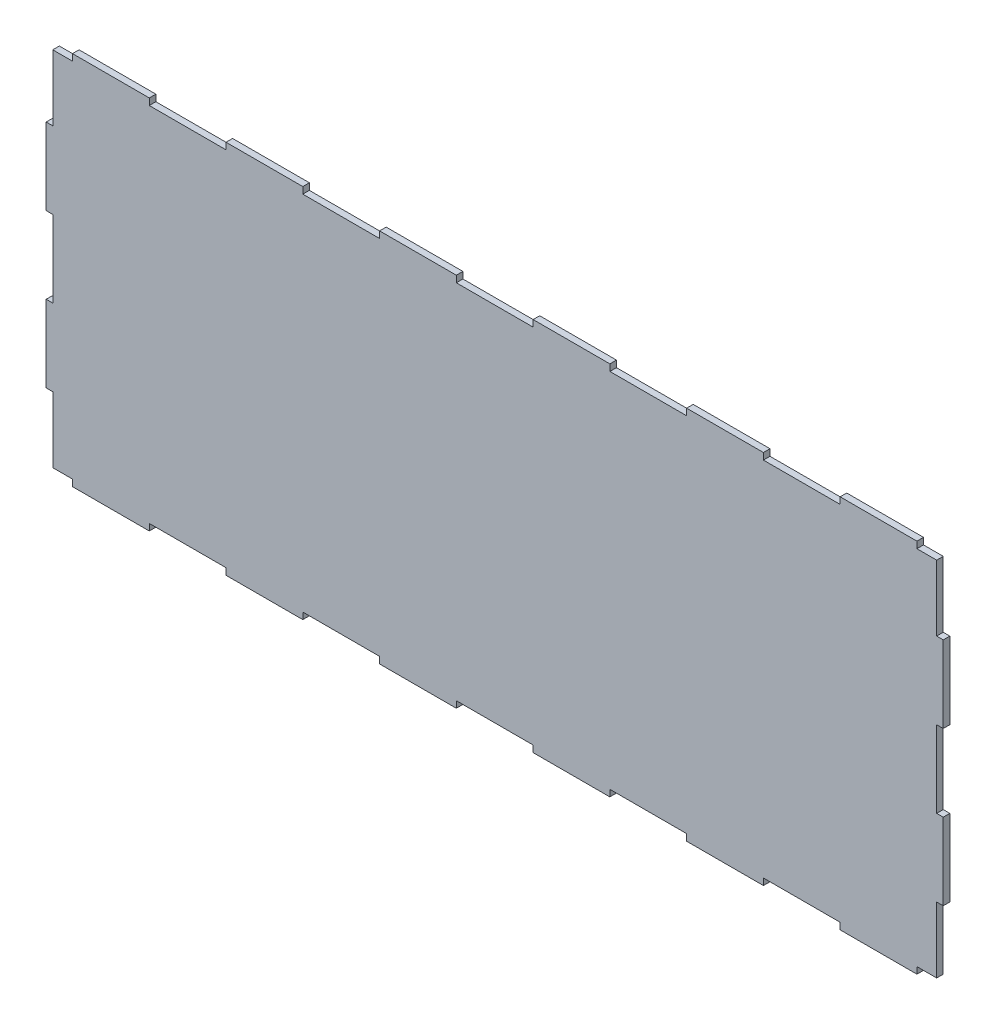
from build123d import *

# Parameters (mm, degrees)
BOSS_EXTRUDE1_DEPTH = 3


with BuildPart() as part:
    # Model → Boss-Extrude1 (new body)
    with BuildSketch(Plane.XY):
        Polygon((192.5, 85.5), (157.5, 85.5), (157.5, 82.5), (122.5, 82.5), (122.5, 85.5), (87.5, 85.5), (87.5, 82.5), (52.5, 82.5), (52.5, 85.5), (17.5, 85.5), (17.5, 82.5), (-17.5, 82.5), (-17.5, 85.5), (-52.5, 85.5), (-52.5, 82.5), (-87.5, 82.5), (-87.5, 85.5), (-122.5, 85.5), (-122.5, 82.5), (-157.5, 82.5), (-157.5, 85.5), (-192.5, 85.5), (-192.5, 82.5), (-201.5, 82.5), (-201.5, 52.5), (-204.5, 52.5), (-204.5, 17.5), (-201.5, 17.5), (-201.5, -17.5), (-204.5, -17.5), (-204.5, -52.5), (-201.5, -52.5), (-201.5, -82.5), (-192.5, -82.5), (-192.5, -85.5), (-157.5, -85.5), (-157.5, -82.5), (-122.5, -82.5), (-122.5, -85.5), (-87.5, -85.5), (-87.5, -82.5), (-52.5, -82.5), (-52.5, -85.5), (-17.5, -85.5), (-17.5, -82.5), (17.5, -82.5), (17.5, -85.5), (52.5, -85.5), (52.5, -82.5), (87.5, -82.5), (87.5, -85.5), (122.5, -85.5), (122.5, -82.5), (157.5, -82.5), (157.5, -85.5), (192.5, -85.5), (192.5, -82.5), (201.5, -82.5), (201.5, -52.5), (204.5, -52.5), (204.5, -17.5), (201.5, -17.5), (201.5, 17.5), (204.5, 17.5), (204.5, 52.5), (201.5, 52.5), (201.5, 82.5), (192.5, 82.5), align=None)
    extrude(amount=BOSS_EXTRUDE1_DEPTH)


solid = part.part
